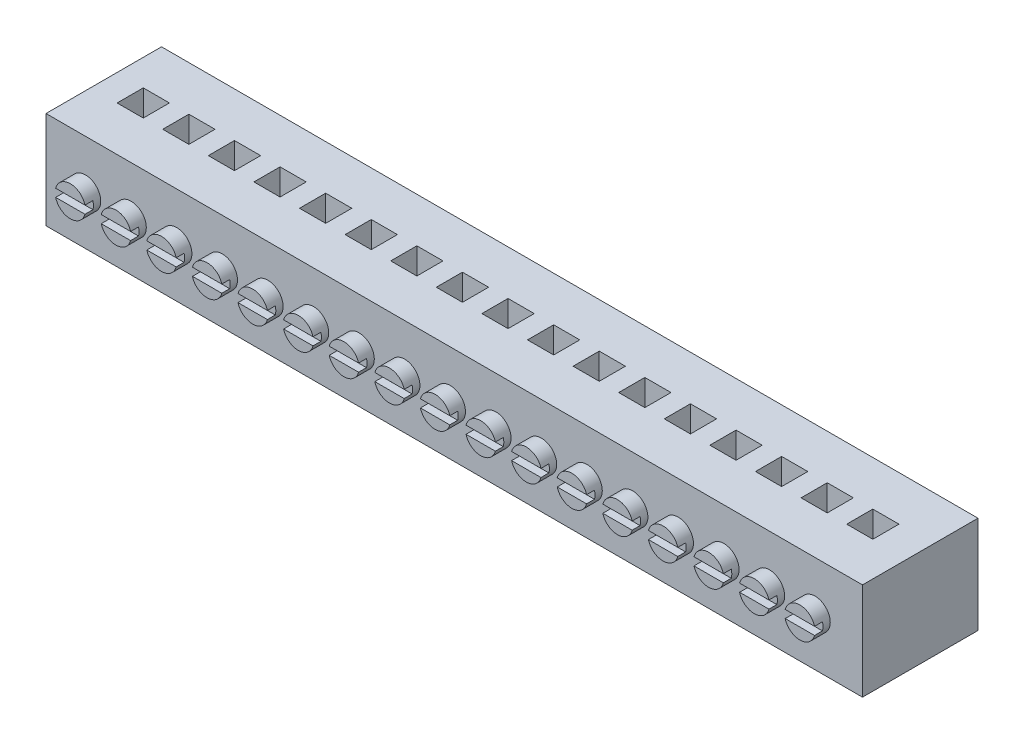
from build123d import *

# Parameters (mm, degrees)
SKETCH1_W        = 134.3
SKETCH1_H        = 16
STRIP_BASE_DEPTH = 9.5
SKETCH2_R        = 2.5
SCREW_BODY_DEPTH = 2.5
SCREW_START      = -1.3
SCREW_SLOT_DEPTH = 3.8
SKETCH4_W        = 4.3
SKETCH4_H        = 4.3
WIRE_HOLE_DEPTH  = 71.065130414
LPATTERN1_COUNT  = 17
LPATTERN1_PITCH  = 7.5


with BuildPart() as part:
    # Sketch1 → strip base (new, symmetric)
    with BuildSketch(Plane.XY):
        Rectangle(SKETCH1_W, SKETCH1_H)
    extrude(amount=STRIP_BASE_DEPTH, both=True)

    # Sketch2 → screw body (add)
    with BuildSketch(Plane.XY.offset(9.5)):
        with Locations((-60.65, 0)):
            Circle(SKETCH2_R)
    screw_body = extrude(amount=SCREW_BODY_DEPTH)

    # Sketch3 → screw slot (cut)
    with BuildSketch(Plane.XY.offset(12).offset(SCREW_START)):
        Polygon((-58.150833414, 0.653197042), (-63.150829324, 0.646801894), (-63.149166586, -0.653197042), (-58.149170676, -0.646801894), align=None)
    screw_slot = extrude(amount=SCREW_SLOT_DEPTH, mode=Mode.SUBTRACT)

    # Sketch4 → wire hole (cut, through all)
    with BuildSketch(Plane.XZ.offset(8)):
        with Locations((-60.65, 0)):
            Rectangle(SKETCH4_W, SKETCH4_H)
    wire_hole = extrude(amount=-WIRE_HOLE_DEPTH, mode=Mode.SUBTRACT)

    # LPattern1: screw body, screw slot, wire hole ×17
    with Locations(*[(i * LPATTERN1_PITCH, 0, 0) for i in range(1, LPATTERN1_COUNT)]):
        add(screw_body)
        add(screw_slot, mode=Mode.SUBTRACT)
        add(wire_hole, mode=Mode.SUBTRACT)


solid = part.part
